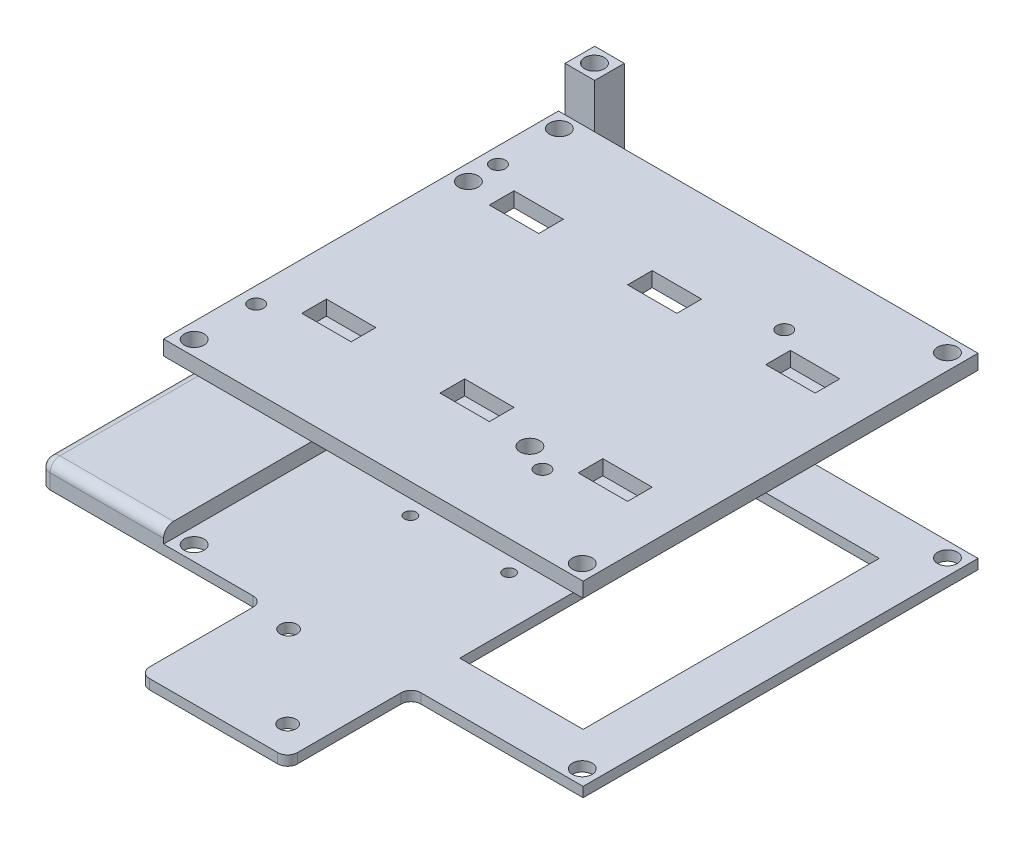
from build123d import *

# Parameters (mm, degrees)
SKETCH1_W               = 110
SKETCH1_H               = 80
SKETCH1_W_2             = 30
SKETCH1_H_2             = 27
SKETCH1_H_3             = 25
BOSS_EXTRUDE1_DEPTH     = 2
SKETCH2_W               = 25
SKETCH2_H               = 80
BOSS_EXTRUDE2_DEPTH     = 3
SKETCH3_R               = 3.375
CUT_EXTRUDE1_DEPTH      = 6
SKETCH4_R               = 1.2
CUT_EXTRUDE2_DEPTH      = 6
SKETCH5_R               = 1.7
CUT_EXTRUDE3_DEPTH      = 6
SKETCH7_W               = 85
SKETCH7_H               = 80
BOSS_EXTRUDE4_DEPTH     = 3
SKETCH10_W              = 25
SKETCH10_H              = 60
CUT_EXTRUDE6_DEPTH      = 4
CUT_EXTRUDE7_DEPTH      = 10
CUT_EXTRUDE7_DEPTH_BACK = 10
SKETCH8_R               = 1.5
SKETCH8_R_2             = 2
CUT_EXTRUDE8_DEPTH      = 10
CUT_EXTRUDE8_DEPTH_BACK = 10
SKETCH9_W               = 10
SKETCH9_H               = 5
SKETCH11_R              = 2
CUT_EXTRUDE9_DEPTH      = 101.751717342
FILLET1_R               = 2
SKETCH14_W              = 6
SKETCH14_H              = 6
SKETCH14_R              = 2
BOSS_EXTRUDE5_DEPTH     = 30


with BuildPart() as part:
    # Sketch1 → Boss-Extrude1 (new body)
    with BuildSketch(Plane(origin=(0, 0, 0), x_dir=(1, 0, 0), z_dir=(0, 1, 0))):
        with Locations((6.857819905, 2.860709015)):
            Rectangle(SKETCH1_W, SKETCH1_H)
        with Locations((11.857819905, 56.360709015)):
            Rectangle(SKETCH1_W_2, SKETCH1_H_2)
        with Locations((11.982265848, -49.639290985)):
            Rectangle(SKETCH1_W_2, SKETCH1_H_3)
    extrude(amount=BOSS_EXTRUDE1_DEPTH)

    # Sketch2 → Boss-Extrude2 (add)
    with BuildSketch(Plane(origin=(0, 2, 0), x_dir=(1, 0, 0), z_dir=(0, 1, 0))):
        with Locations((-35.642180095, 2.860709015)):
            Rectangle(SKETCH2_W, SKETCH2_H)
    extrude(amount=BOSS_EXTRUDE2_DEPTH)

    # Sketch3 → Cut-Extrude1 (cut)
    with BuildSketch(Plane(origin=(0, 5, 0), x_dir=(1, 0, 0), z_dir=(0, 1, 0))):
        with Locations((-35.642180095, 2.860709015)):
            Circle(SKETCH3_R)
    extrude(amount=-CUT_EXTRUDE1_DEPTH, mode=Mode.SUBTRACT)

    # Sketch4 → Cut-Extrude2 (cut)
    with BuildSketch(Plane(origin=(0, 2, 0), x_dir=(1, 0, 0), z_dir=(0, 1, 0))):
        with Locations((-3.142180095, 12.860709015)):
            Circle(SKETCH4_R)
        with Locations((16.857819905, 12.860709015)):
            Circle(SKETCH4_R)
        with Locations((16.857819905, -7.139290985)):
            Circle(SKETCH4_R)
        with Locations((-3.142180095, -7.139290985)):
            Circle(SKETCH4_R)
    extrude(amount=-CUT_EXTRUDE2_DEPTH, mode=Mode.SUBTRACT)

    # Sketch5 → Cut-Extrude3 (cut)
    with BuildSketch(Plane(origin=(0, 2, 0), x_dir=(1, 0, 0), z_dir=(0, 1, 0))):
        with Locations((1.857819905, 64.860709015)):
            Circle(SKETCH5_R)
        with Locations((21.857819905, 64.860709015)):
            Circle(SKETCH5_R)
        with Locations((21.857819905, 44.860709015)):
            Circle(SKETCH5_R)
        with Locations((1.857819905, 44.860709015)):
            Circle(SKETCH5_R)
        with Locations((20.982265848, -56.139290985)):
            Circle(SKETCH5_R)
        with Locations((4.432265848, -39.389290985)):
            Circle(SKETCH5_R)
    extrude(amount=-CUT_EXTRUDE3_DEPTH, mode=Mode.SUBTRACT)

    # Sketch10 → Cut-Extrude6 (cut)
    with BuildSketch(Plane(origin=(0, 2, 0), x_dir=(1, 0, 0), z_dir=(0, 1, 0))):
        with Locations((39.357819905, 2.860709015)):
            Rectangle(SKETCH10_W, SKETCH10_H)
    extrude(amount=-CUT_EXTRUDE6_DEPTH, mode=Mode.SUBTRACT)


with BuildPart() as body_2:
    # Sketch7 → Boss-Extrude4 (new body)
    with BuildSketch(Plane(origin=(0, 35, 0), x_dir=(1, 0, 0), z_dir=(0, 1, 0))):
        with Locations((19.357819905, 2.860709015)):
            Rectangle(SKETCH7_W, SKETCH7_H)
    extrude(amount=BOSS_EXTRUDE4_DEPTH)

    # Sketch8 → Cut-Extrude7 (cut, two sides: drawn at the far end of the back side and taken through both)
    with BuildSketch(Plane(origin=(0, 38, 0), x_dir=(1, 0, 0), z_dir=(0, 1, 0)).offset(-CUT_EXTRUDE7_DEPTH_BACK)):
        with Locations((-19.892180095, 27.360709015)):
            Circle(SKETCH8_R)
        with Locations((38.107819905, 27.360709015)):
            Circle(SKETCH8_R)
        with Locations((38.107819905, -21.639290985)):
            Circle(SKETCH8_R)
        with Locations((-19.892180095, -21.639290985)):
            Circle(SKETCH8_R)
        with Locations((-19.892180095, 21.360709015)):
            Circle(SKETCH8_R_2)
        with Locations((32.787466192, -18.865514433)):
            Circle(SKETCH8_R_2)
    extrude(amount=CUT_EXTRUDE7_DEPTH + CUT_EXTRUDE7_DEPTH_BACK, mode=Mode.SUBTRACT)

    # Sketch9 → Cut-Extrude8 (cut, two sides: drawn at the far end of the back side and taken through both)
    with BuildSketch(Plane(origin=(0, 38, 0), x_dir=(1, 0, 0), z_dir=(0, 1, 0)).offset(-CUT_EXTRUDE8_DEPTH_BACK)):
        with Locations((19.357819905, 21.860709015)):
            Rectangle(SKETCH9_W, SKETCH9_H)
        with Locations((-8.642180095, 21.860709015)):
            Rectangle(SKETCH9_W, SKETCH9_H)
        with Locations((47.357819905, -16.139290985)):
            Rectangle(SKETCH9_W, SKETCH9_H)
        with Locations((47.357819905, 21.860709015)):
            Rectangle(SKETCH9_W, SKETCH9_H)
        with Locations((19.357819905, -16.139290985)):
            Rectangle(SKETCH9_W, SKETCH9_H)
        with Locations((-8.642180095, -16.139290985)):
            Rectangle(SKETCH9_W, SKETCH9_H)
    extrude(amount=CUT_EXTRUDE8_DEPTH + CUT_EXTRUDE8_DEPTH_BACK, mode=Mode.SUBTRACT)


with BuildPart() as cut_extrude9_tool:
    # Sketch11 → Cut-Extrude9 (new, through all)
    with BuildSketch(Plane(origin=(0, 38, 0), x_dir=(1, 0, 0), z_dir=(0, 1, 0))):
        with Locations((-19.957826311, 39.853154055)):
            Circle(SKETCH11_R)
        with Locations((-19.957826311, -34.131736026)):
            Circle(SKETCH11_R)
        with Locations((58.673466121, -34.131736026)):
            Circle(SKETCH11_R)
        with Locations((58.673466121, 39.853154055)):
            Circle(SKETCH11_R)
    extrude(amount=-CUT_EXTRUDE9_DEPTH)


with BuildPart() as part_1:
    add(part.part)

    # Cut-Extrude9: cut by cut_extrude9_tool
    add(cut_extrude9_tool.part, mode=Mode.SUBTRACT)

    # Fillet1
    fillet1_edges = [part_1.edges().sort_by_distance(p)[0] for p in [
        (26.857819905, 1, -69.860709015),
        (26.857819905, 1, -42.860709015),
        (-3.142180095, 1, -69.860709015),
        (-3.142180095, 1, -42.860709015),
        (-3.017734152, 1, 62.139290985),
        (26.982265848, 1, 62.139290985),
        (26.982265848, 1, 37.139290985),
        (-3.017734152, 1, 37.139290985),
        (-48.142180095, 5, -2.860709015),
        (-35.642180095, 5, -42.860709015),
        (-35.642180095, 5, 37.139290985),
        (-48.142180095, 2.5, 37.139290985),
        (-48.142180095, 2.5, -42.860709015),
    ]]
    fillet(fillet1_edges, radius=FILLET1_R)


with BuildPart() as body_2_1:
    add(body_2.part)

    # Cut-Extrude9: cut by cut_extrude9_tool
    add(cut_extrude9_tool.part, mode=Mode.SUBTRACT)


with BuildPart() as body_3:
    # Sketch14 → Boss-Extrude5 (new body)
    with BuildSketch(Plane(origin=(0, 0, 0), x_dir=(1, 0, 0), z_dir=(0, 1, 0))):
        with Locations((-35.83282246, 62.894728504)):
            Rectangle(SKETCH14_W, SKETCH14_H)
        with Locations((-35.883432365, 62.894728504)):
            Circle(SKETCH14_R, mode=Mode.SUBTRACT)
    extrude(amount=BOSS_EXTRUDE5_DEPTH)


solid = Compound([part_1.part, body_2_1.part, body_3.part])
